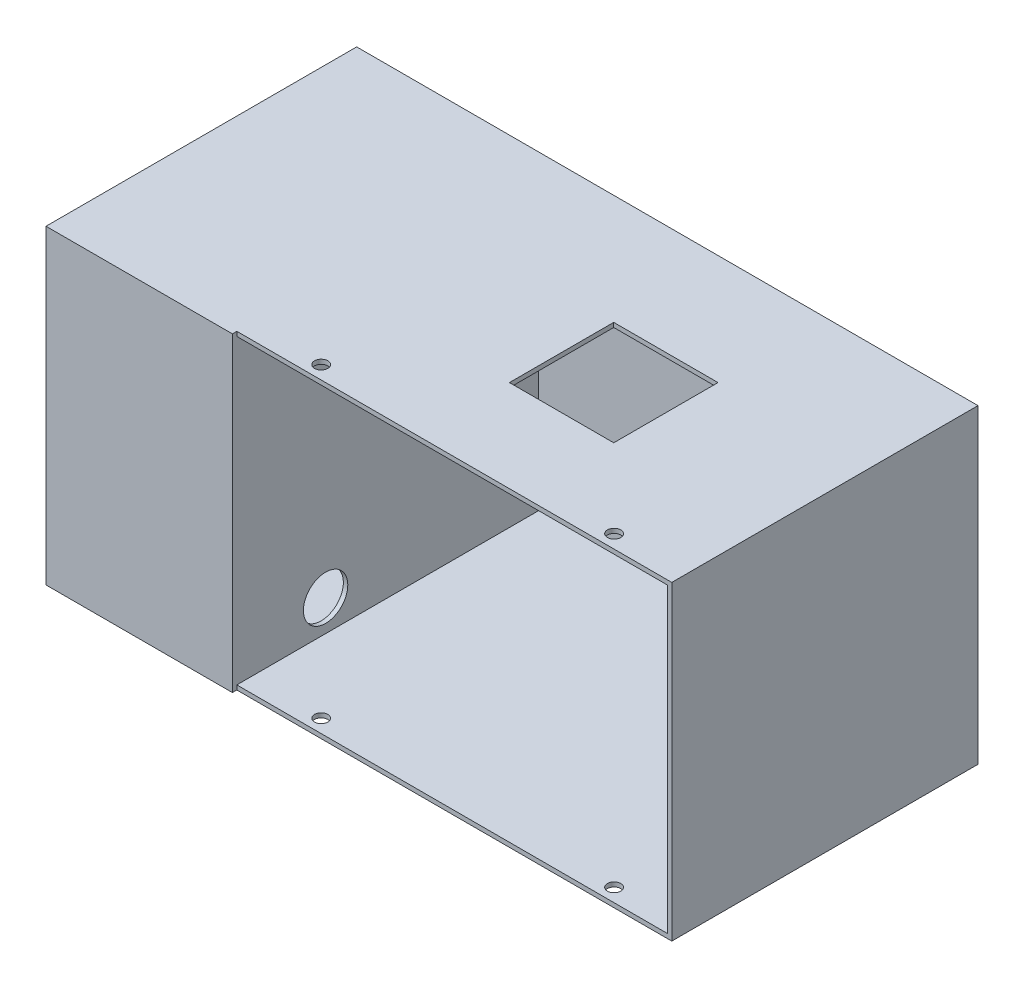
from build123d import *

# Parameters (mm, degrees)
SKETCH_1_W          = 140
SKETCH_1_H          = 70
SKETCH_1_W_2        = 138
SKETCH_1_H_2        = 68
EXTRUDE_1_DEPTH     = 70
SKETCH_1_3_W        = 140
SKETCH_1_3_H        = 70
EXTRUDE_1_2_DEPTH   = 1
SKETCH_2_W          = 1
SKETCH_2_H          = 68
EXTRUDE_1_3_DEPTH   = 68
SKETCH_3_W          = 68
SKETCH_3_H          = 68
CUT_EXTRUDE_1_DEPTH = 25
SKETCH_4_W          = 1
SKETCH_4_H          = 70
EXTRUDE_2_DEPTH     = 42
SKETCH_5_R          = 5
SKETCH_5_R_2        = 3
EXTRUDE_3_DEPTH     = 20
SKETCH_6_W          = 68
SKETCH_6_H          = 1
EXTRUDE_4_DEPTH     = 41.5
SKETCH_8_R          = 1.5
CUT_EXTRUDE_2_DEPTH = 100
SKETCH_10_W         = 98
SKETCH_10_H         = 70
CUT_EXTRUDE_5_DEPTH = 1
SKETCH_11_R         = 1.5
CUT_EXTRUDE_6_DEPTH = 1.5
SKETCH_12_W         = 23.5
SKETCH_12_H         = 23.5
CUT_EXTRUDE_7_DEPTH = 28.5
SKETCH_13_R         = 5
CUT_EXTRUDE_8_DEPTH = 16.5


with BuildPart() as part:
    # Эскиз1 → Extrude 1 (new body)
    with BuildSketch(Plane.XY):
        with Locations((15.470629231, 4.392672242)):
            Rectangle(SKETCH_1_W, SKETCH_1_H)
        with Locations((15.470629231, 4.392672242)):
            Rectangle(SKETCH_1_W_2, SKETCH_1_H_2, mode=Mode.SUBTRACT)
    extrude(amount=EXTRUDE_1_DEPTH)

    # Эскиз1<3> → Extrude 1 2 (add)
    with BuildSketch(Plane.XY):
        with Locations((15.470629231, 4.392672242)):
            Rectangle(SKETCH_1_3_W, SKETCH_1_3_H)
    extrude(amount=EXTRUDE_1_2_DEPTH)

    # 草图2 → Extrude 1 3 (add)
    with BuildSketch(Plane.XY.offset(1)):
        with Locations((-13.029370769, 4.392672242)):
            Rectangle(SKETCH_2_W, SKETCH_2_H)
    extrude(amount=EXTRUDE_1_3_DEPTH)

    # 草图3 → 切除-拉伸1 (cut)
    with BuildSketch(Plane.ZY.offset(54.529370769)):
        with Locations((35, 4.392672242)):
            Rectangle(SKETCH_3_W, SKETCH_3_H)
    extrude(amount=-CUT_EXTRUDE_1_DEPTH, mode=Mode.SUBTRACT)

    # 草图4 → 凸台-拉伸2 (add)
    with BuildSketch(Plane.ZY.offset(54.529370769)):
        with Locations((69.5, 4.392672242)):
            Rectangle(SKETCH_4_W, SKETCH_4_H)
    extrude(amount=-EXTRUDE_2_DEPTH)

    # 草图5 → 凸台-拉伸3 (add)
    with BuildSketch(Plane.ZY.offset(13.529370769)):
        with Locations((35, 14.392672242)):
            Circle(SKETCH_5_R)
        with Locations((35, 14.392672242)):
            Circle(SKETCH_5_R_2, mode=Mode.SUBTRACT)
    extrude(amount=EXTRUDE_3_DEPTH)

    # 草图6 → 凸台-拉伸4 (add)
    with BuildSketch(Plane.ZY.offset(13.529370769)):
        with Locations((35, -14.107327758)):
            Rectangle(SKETCH_6_W, SKETCH_6_H)
    extrude(amount=EXTRUDE_4_DEPTH)

    # 草图8 → 切除-拉伸2 (cut, symmetric)
    with BuildSketch(Plane.XZ.offset(-38.392672242)):
        with Locations((3.470629231, 66)):
            Circle(SKETCH_8_R)
        with Locations((69.470629231, 66)):
            Circle(SKETCH_8_R)
    extrude(amount=CUT_EXTRUDE_2_DEPTH, both=True, mode=Mode.SUBTRACT)

    # 草图10 → 切除-拉伸5 (cut)
    with BuildSketch(Plane.XY.offset(70)):
        with Locations((36.470629231, 4.392672242)):
            Rectangle(SKETCH_10_W, SKETCH_10_H)
    extrude(amount=-CUT_EXTRUDE_5_DEPTH, mode=Mode.SUBTRACT)

    # 草图11 → 切除-拉伸6 (cut)
    with BuildSketch(Plane(origin=(0, -13.607327758, 0), x_dir=(1, 0, 0), z_dir=(0, 1, 0))):
        with Locations((-48.938859946, -61.922756224)):
            Circle(SKETCH_11_R)
    extrude(amount=-CUT_EXTRUDE_6_DEPTH, mode=Mode.SUBTRACT)

    # 草图12 → 切除-拉伸7 (cut)
    with BuildSketch(Plane(origin=(0, 39.392672242, 0), x_dir=(1, 0, 0), z_dir=(0, 1, 0))):
        with Locations((39.938426457, -36.544993355)):
            Rectangle(SKETCH_12_W, SKETCH_12_H)
    extrude(amount=-CUT_EXTRUDE_7_DEPTH, mode=Mode.SUBTRACT)

    # 草图13 → 切除-拉伸8 (cut)
    with BuildSketch(Plane.ZY.offset(13.529370769)):
        with Locations((49, -22.607327758)):
            Circle(SKETCH_13_R)
    extrude(amount=-CUT_EXTRUDE_8_DEPTH, mode=Mode.SUBTRACT)


solid = part.part
